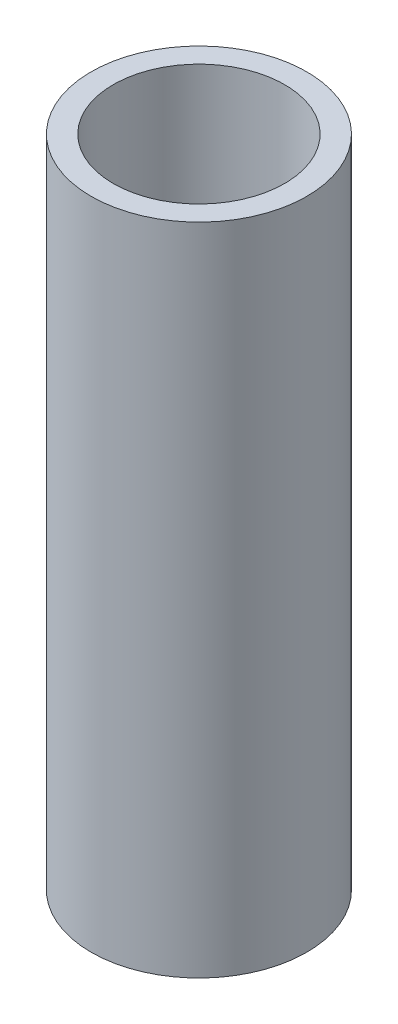
from build123d import *

# Parameters (mm, degrees)
SKETCH1_R           = 2.9972
SKETCH1_R_2         = 2.38125
BOSS_EXTRUDE1_DEPTH = 9.094875003


with BuildPart() as part:
    # Sketch1 → Boss-Extrude1 (new, symmetric)
    with BuildSketch(Plane(origin=(0, 0, 0), x_dir=(1, 0, 0), z_dir=(0, 1, 0))):
        with Locations(Location((0, 0, 0), (0, 0, 270))):
            Circle(SKETCH1_R)
        with Locations(Location((0, 0, 0), (0, 0, 270))):
            Circle(SKETCH1_R_2, mode=Mode.SUBTRACT)
    extrude(amount=BOSS_EXTRUDE1_DEPTH, both=True)


solid = part.part
